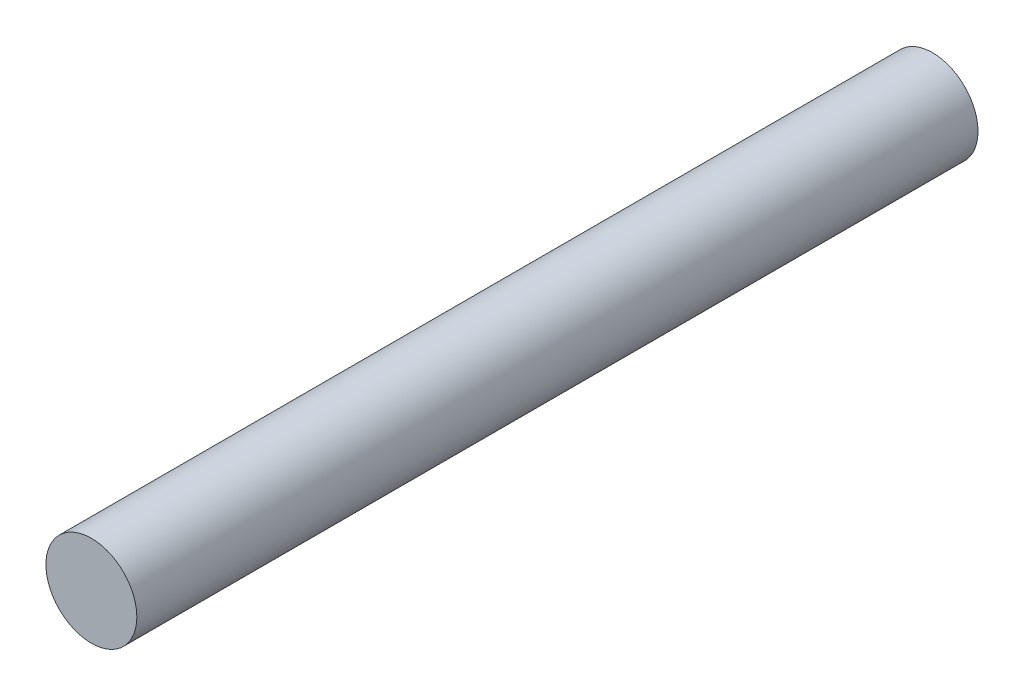
from build123d import *

# Parameters (mm, degrees)
SCHIZZO1_R                   = 2
ESTRUSIONE_ESTRUSIONE1_DEPTH = 37


with BuildPart() as part:
    # Schizzo1 → Estrusione-Estrusione1 (new body)
    with BuildSketch(Plane.XY):
        Circle(SCHIZZO1_R)
    extrude(amount=ESTRUSIONE_ESTRUSIONE1_DEPTH)


solid = part.part
